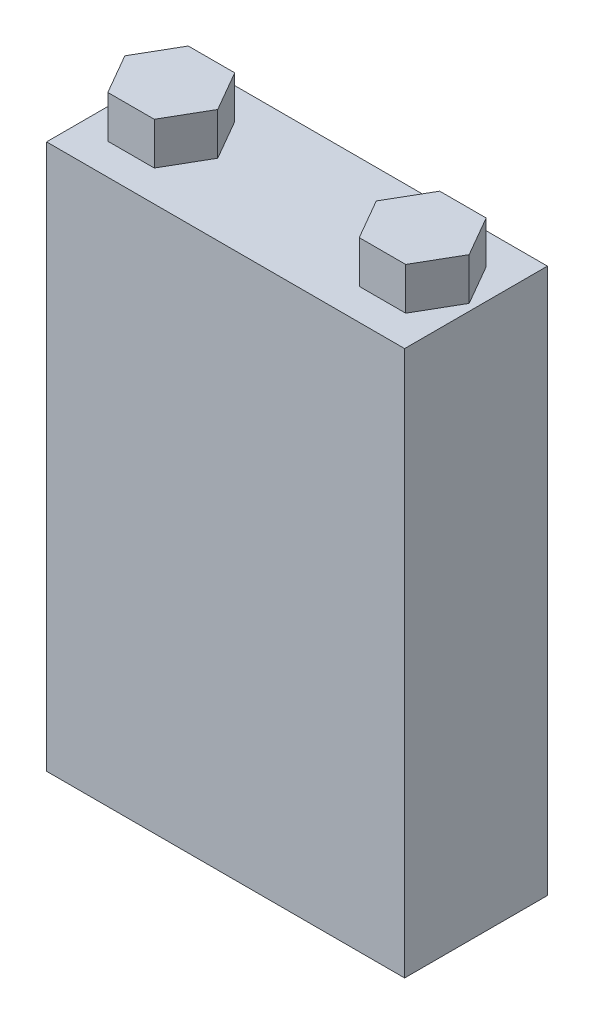
from build123d import *

# Parameters (mm, degrees)
SKETCH1_W           = 178
SKETCH1_H           = 71
BOSS_EXTRUDE1_DEPTH = 271
BOSS_EXTRUDE2_DEPTH = 21


with BuildPart() as part:
    # Sketch1 → Boss-Extrude1 (new body)
    with BuildSketch(Plane(origin=(0, 0, 0), x_dir=(1, 0, 0), z_dir=(0, 1, 0))):
        Rectangle(SKETCH1_W, SKETCH1_H)
    extrude(amount=BOSS_EXTRUDE1_DEPTH)

    # Sketch2 → Boss-Extrude2 (add)
    with BuildSketch(Plane(origin=(0, 271, 0), x_dir=(1, 0, 0), z_dir=(0, 1, 0))):
        Polygon((-39.405989232, 0), (-50.952994616, 20), (-74.047005384, 20), (-85.594010768, 0), (-74.047005384, -20), (-50.952994616, -20), align=None)
        Polygon((85.594010768, 0), (74.047005384, 20), (50.952994616, 20), (39.405989232, 0), (50.952994616, -20), (74.047005384, -20), align=None)
    extrude(amount=BOSS_EXTRUDE2_DEPTH)


solid = part.part
